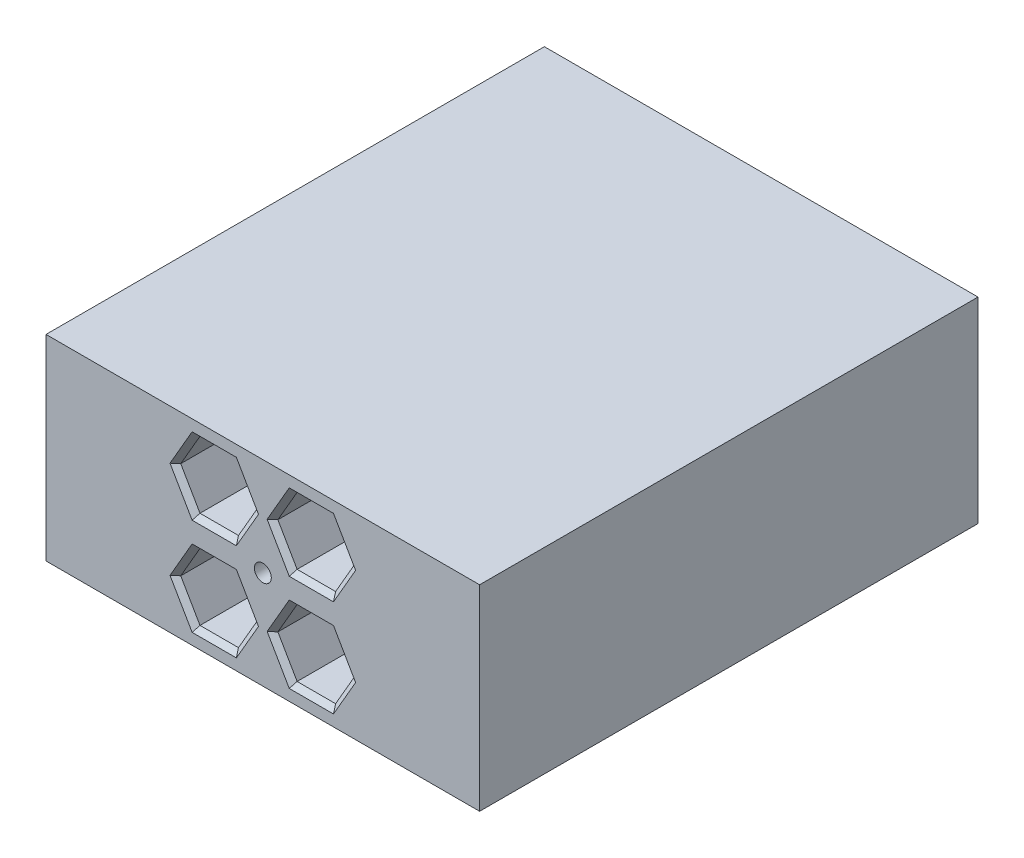
from build123d import *

# Parameters (mm, degrees)
SKETCH1_W                = 44.2
SKETCH1_H                = 20
BOSS_EXTRUDE1_DEPTH      = 50.8
SKETCH2_R                = 0.863384433
CUT_EXTRUDE1_DEPTH       = 6.35
CHAMFER1_SIZE            = 0.508
CHAMFER1_OF_MIRROR2_SIZE = 0.508


with BuildPart() as part:
    # Sketch1 → Boss-Extrude1 (new body)
    with BuildSketch(Plane.XY):
        with Locations((22.1, 10)):
            Rectangle(SKETCH1_W, SKETCH1_H)
    extrude(amount=BOSS_EXTRUDE1_DEPTH)

    # Sketch2 → Cut-Extrude1 (cut)
    with BuildSketch(Plane(origin=(0, 0, 0), x_dir=(-1, 0, 0), z_dir=(0, 0, -1))):
        with Locations((-22.1, 10)):
            Circle(SKETCH2_R)
        Polygon((-25.088596798, 18.34725), (-29.011403202, 18.34725), (-30.972806404, 14.95), (-29.011403202, 11.55275), (-25.088596798, 11.55275), (-23.127193596, 14.95), align=None)
        Polygon((-15.188596798, 18.34725), (-19.111403202, 18.34725), (-21.072806404, 14.95), (-19.111403202, 11.55275), (-15.188596798, 11.55275), (-13.227193596, 14.95), align=None)
        Polygon((-15.188596798, 8.44725), (-19.111403202, 8.44725), (-21.072806404, 5.05), (-19.111403202, 1.65275), (-15.188596798, 1.65275), (-13.227193596, 5.05), align=None)
        Polygon((-25.088596798, 8.44725), (-29.011403202, 8.44725), (-30.972806404, 5.05), (-29.011403202, 1.65275), (-25.088596798, 1.65275), (-23.127193596, 5.05), align=None)
    cut_extrude1 = extrude(amount=-CUT_EXTRUDE1_DEPTH, mode=Mode.SUBTRACT)

    # Chamfer1
    chamfer1_edges = [part.edges().sort_by_distance(p)[0] for p in [
        (24.107895197, 6.748625, 0),
        (27.05, 8.44725, 0),
        (29.992104803, 6.748625, 0),
        (29.992104803, 3.351375, 0),
        (27.05, 1.65275, 0),
        (24.107895197, 3.351375, 0),
        (14.207895197, 6.748625, 0),
        (17.15, 8.44725, 0),
        (20.092104803, 6.748625, 0),
        (20.092104803, 3.351375, 0),
        (17.15, 1.65275, 0),
        (14.207895197, 3.351375, 0),
        (14.207895197, 16.648625, 0),
        (17.15, 18.34725, 0),
        (20.092104803, 16.648625, 0),
        (20.092104803, 13.251375, 0),
        (17.15, 11.55275, 0),
        (14.207895197, 13.251375, 0),
        (24.107895197, 16.648625, 0),
        (27.05, 18.34725, 0),
        (29.992104803, 16.648625, 0),
        (29.992104803, 13.251375, 0),
        (27.05, 11.55275, 0),
        (24.107895197, 13.251375, 0),
    ]]
    chamfer(chamfer1_edges, length=CHAMFER1_SIZE)

    # Mirror2: Cut-Extrude1 across plane
    add(cut_extrude1.mirror(Plane(origin=(0, 0, 25.4), x_dir=(1, 0, 0), z_dir=(0, 0, -1))), mode=Mode.SUBTRACT)

    # Chamfer1 of Mirror2
    chamfer1_of_mirror2_edges = [part.edges().sort_by_distance(p)[0] for p in [
        (24.107895197, 6.748625, 50.8),
        (27.05, 8.44725, 50.8),
        (29.992104803, 6.748625, 50.8),
        (29.992104803, 3.351375, 50.8),
        (27.05, 1.65275, 50.8),
        (24.107895197, 3.351375, 50.8),
        (14.207895197, 6.748625, 50.8),
        (17.15, 8.44725, 50.8),
        (20.092104803, 6.748625, 50.8),
        (20.092104803, 3.351375, 50.8),
        (17.15, 1.65275, 50.8),
        (14.207895197, 3.351375, 50.8),
        (14.207895197, 16.648625, 50.8),
        (17.15, 18.34725, 50.8),
        (20.092104803, 16.648625, 50.8),
        (20.092104803, 13.251375, 50.8),
        (17.15, 11.55275, 50.8),
        (14.207895197, 13.251375, 50.8),
        (24.107895197, 16.648625, 50.8),
        (27.05, 18.34725, 50.8),
        (29.992104803, 16.648625, 50.8),
        (29.992104803, 13.251375, 50.8),
        (27.05, 11.55275, 50.8),
        (24.107895197, 13.251375, 50.8),
    ]]
    chamfer(chamfer1_of_mirror2_edges, length=CHAMFER1_OF_MIRROR2_SIZE)


solid = part.part
